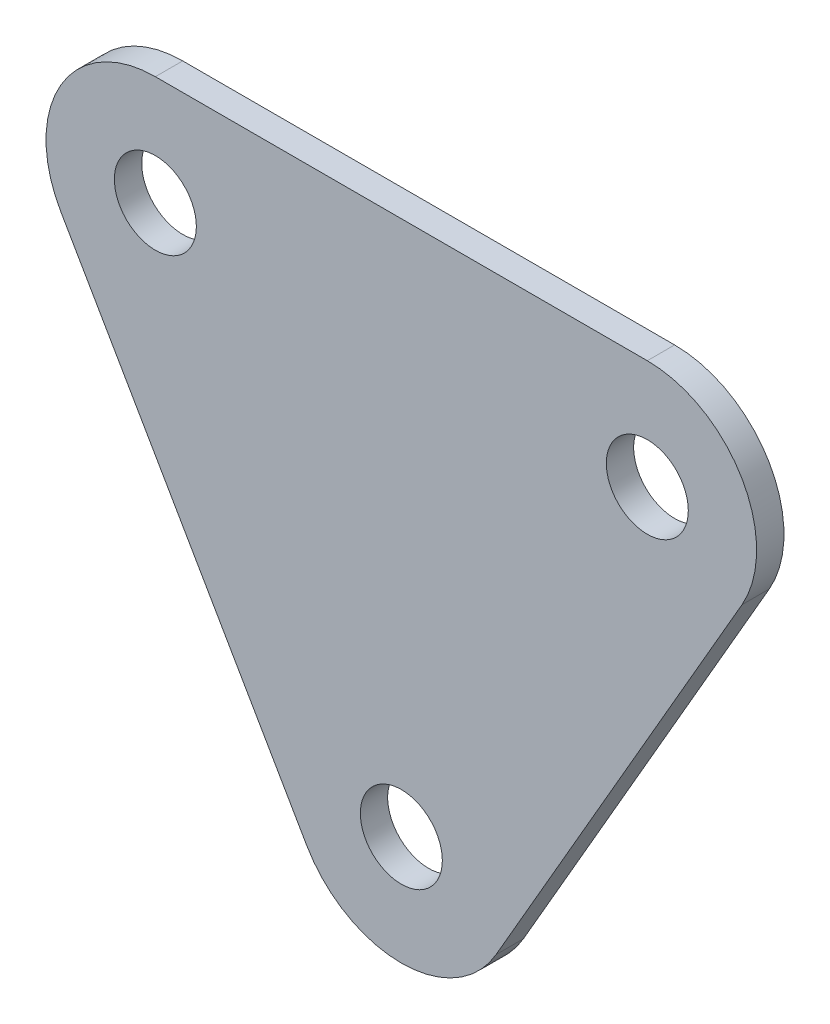
from build123d import *

# Parameters (mm, degrees)
SKETCH1_R           = 30
BOSS_EXTRUDE1_DEPTH = 20


with BuildPart() as part:
    # Sketch1 → Boss-Extrude1 (new body)
    with BuildSketch(Plane.XY):
        with BuildLine():
            Line((0, 0), (360, 0))
            ThreePointArc((360, 0), (429.282032303, -40), (429.282032303, -120))
            Line((429.282032303, -120), (249.282032303, -431.769145362))
            ThreePointArc((249.282032303, -431.769145362), (180, -471.769145362), (110.717967697, -431.769145362))
            Line((110.717967697, -431.769145362), (-69.282032303, -120))
            ThreePointArc((-69.282032303, -120), (-69.282032303, -40), (0, 0))
        make_face()
        with Locations((0, -80)):
            Circle(SKETCH1_R, mode=Mode.SUBTRACT)
        with Locations((360, -80)):
            Circle(SKETCH1_R, mode=Mode.SUBTRACT)
        with Locations((180, -391.769145362)):
            Circle(SKETCH1_R, mode=Mode.SUBTRACT)
    extrude(amount=BOSS_EXTRUDE1_DEPTH)


solid = part.part
